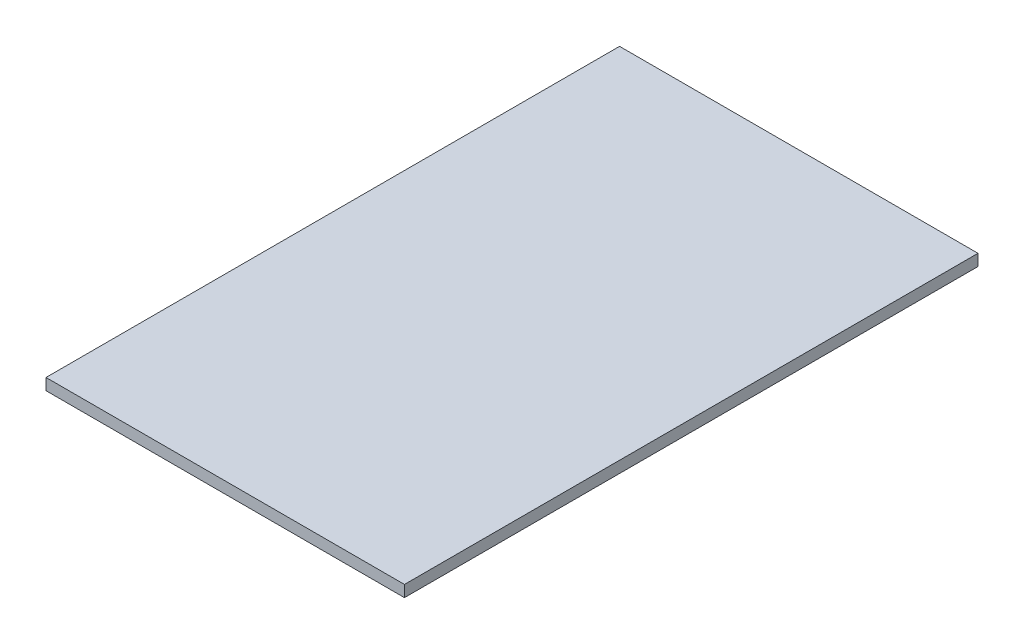
from build123d import *

# Parameters (mm, degrees)
SKETCH1_W           = 50
SKETCH1_H           = 80
BOSS_EXTRUDE1_DEPTH = 1.6


with BuildPart() as part:
    # Sketch1 → Boss-Extrude1 (new body)
    with BuildSketch(Plane(origin=(0, 0, 0), x_dir=(1, 0, 0), z_dir=(0, 1, 0))):
        with Locations((25, 40)):
            Rectangle(SKETCH1_W, SKETCH1_H)
    extrude(amount=BOSS_EXTRUDE1_DEPTH)


solid = part.part
